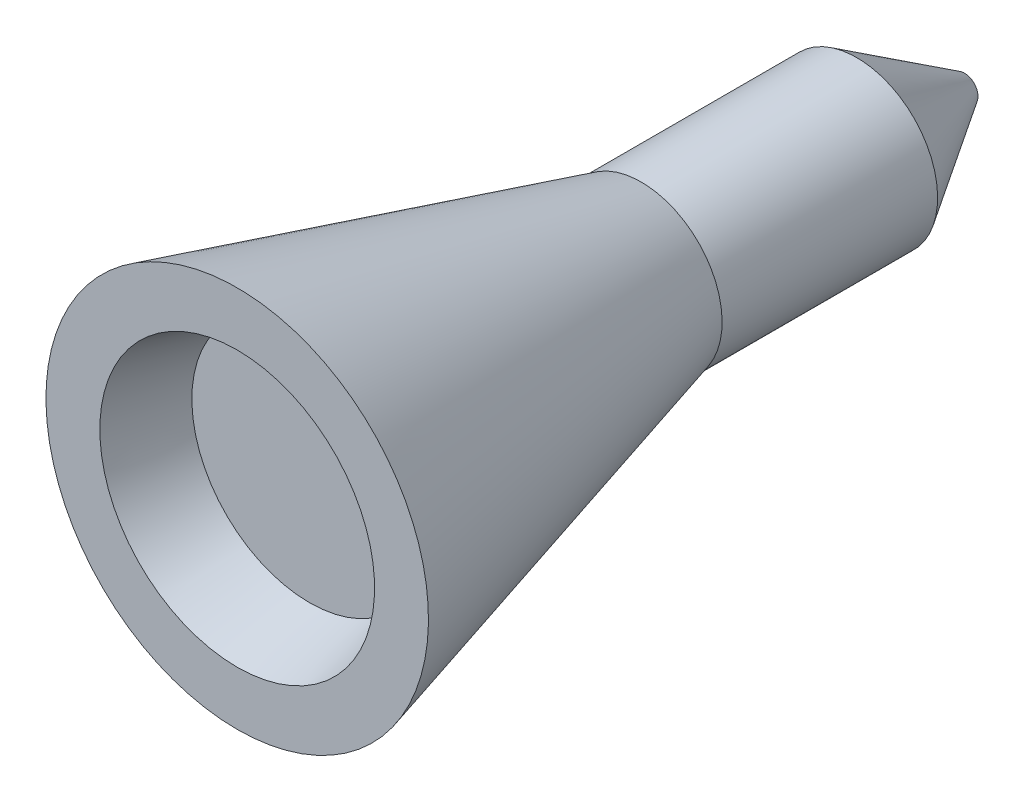
from build123d import *

# Parameters (mm, degrees)
SKETCH2_W = 20.317073171
SKETCH2_H = 3


with BuildPart() as part:
    # Sketch2 → Revolve1 (revolve)
    with BuildSketch(Plane(origin=(0, 0, 0), x_dir=(0, 0, -1), z_dir=(1, 0, 0)), mode=Mode.PRIVATE) as revolve1_sk:
        with Locations((5.158536586, -1.5)):
            Rectangle(SKETCH2_W, SKETCH2_H)
        Polygon((-5, 1.366666667), (-5, 0), (0, 0), align=None)
        Polygon((-5, 1.366666667), (0, 0), (7.317073171, 0), (-7.682926829, 4.1), (-7.682926829, 2.1), align=None)
        Polygon((19.317073171, -3), (15.317073171, -3), (15.317073171, 0), (19.317073171, -2.5), align=None)
    revolve(revolve1_sk.sketch.rotate(Axis((0, -3, 5), (0, 0, -1)), 180), axis=Axis((0, -3, 5), (0, 0, -1)))


solid = part.part
